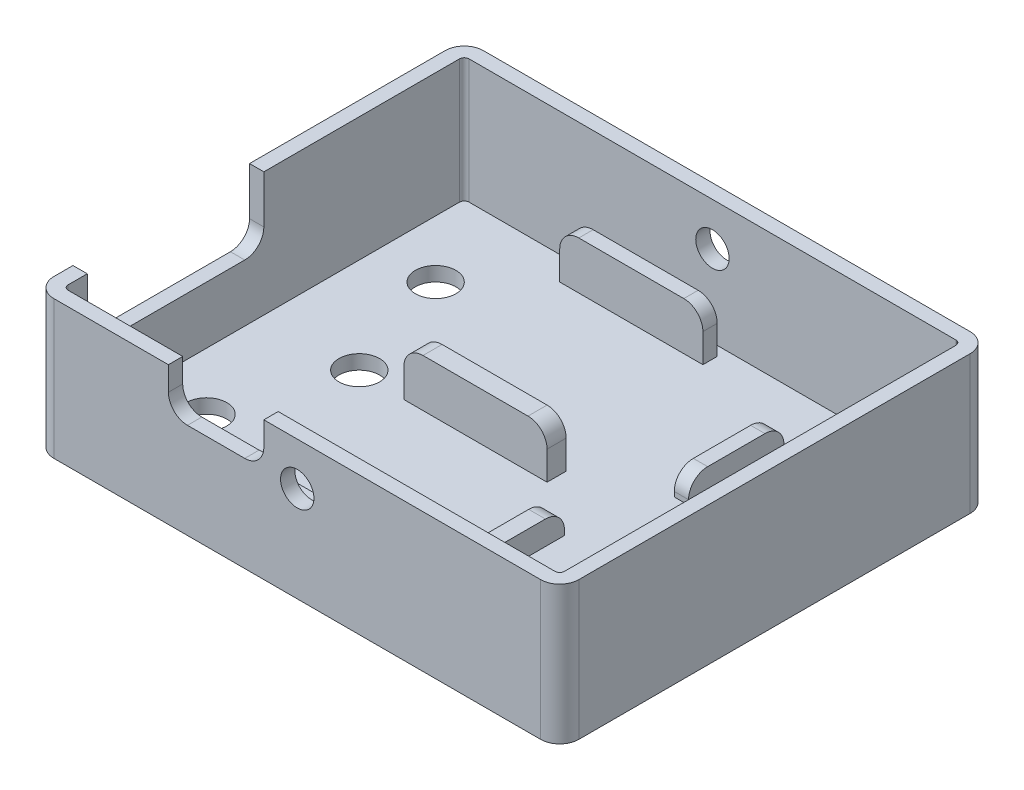
from build123d import *

# Parameters (mm, degrees)
SALIENTE_EXTRUIR1_DEPTH = 1.5
SALIENTE_EXTRUIR3_DEPTH = 13
CROQUIS4_W              = 15
CROQUIS4_H              = 1.5
CROQUIS4_H_2            = 2
SALIENTE_EXTRUIR4_DEPTH = 5
CROQUIS5_W              = 1.5
CROQUIS5_H              = 10
CROQUIS5_W_2            = 1.75
SALIENTE_EXTRUIR5_DEPTH = 2.5
CROQUIS6_W              = 18.5
CROQUIS6_H              = 7
CORTAR_EXTRUIR1_DEPTH   = 1.5
CROQUIS7_W              = 10
CROQUIS7_H              = 4.5
CORTAR_EXTRUIR2_DEPTH   = 1.5
CROQUIS8_R              = 2.25
CROQUIS8_R_2            = 1.5
SALIENTE_EXTRUIR6_DEPTH = 2.25
CORTAR_EXTRUIR3_REACH   = 56.695
CROQUIS9_R              = 1.75
CROQUIS10_R             = 2.125
CORTAR_EXTRUIR4_DEPTH   = 1.5
CROQUIS11_R             = 2.125
CORTAR_EXTRUIR5_DEPTH   = 1.5
SALIENTE_EXTRUIR8_DEPTH = 1.5
SALIENTE_EXTRUIR9_DEPTH = 1.5
REDONDEO2_R             = 2


with BuildPart() as part:
    # Croquis1 → Saliente-Extruir1 (new body)
    with BuildSketch(Plane(origin=(0, 0, 0), x_dir=(1, 0, 0), z_dir=(0, 1, 0))):
        with BuildLine():
            Line((-25.5, -22.5), (25.5, -22.5))
            ThreePointArc((25.5, -22.5), (26.914213562, -21.914213562), (27.5, -20.5))
            Line((27.5, -20.5), (27.5, 20.5))
            ThreePointArc((27.5, 20.5), (26.914213562, 21.914213562), (25.5, 22.5))
            Line((25.5, 22.5), (-25.5, 22.5))
            ThreePointArc((-25.5, 22.5), (-26.914213562, 21.914213562), (-27.5, 20.5))
            Line((-27.5, 20.5), (-27.5, -20.5))
            ThreePointArc((-27.5, -20.5), (-26.914213562, -21.914213562), (-25.5, -22.5))
        make_face()
    extrude(amount=SALIENTE_EXTRUIR1_DEPTH)

    # Croquis3 → Saliente-Extruir3 (add)
    with BuildSketch(Plane(origin=(0, 1.5, 0), x_dir=(1, 0, 0), z_dir=(0, 1, 0))):
        with BuildLine():
            Line((-25.5, 22.5), (25.5, 22.5))
            ThreePointArc((25.5, 22.5), (26.914213562, 21.914213562), (27.5, 20.5))
            Line((27.5, 20.5), (27.5, -20.5))
            ThreePointArc((27.5, -20.5), (26.914213562, -21.914213562), (25.5, -22.5))
            Line((25.5, -22.5), (-25.5, -22.5))
            ThreePointArc((-25.5, -22.5), (-26.914213562, -21.914213562), (-27.5, -20.5))
            Line((-27.5, -20.5), (-27.5, 20.5))
            ThreePointArc((-27.5, 20.5), (-26.914213562, 21.914213562), (-25.5, 22.5))
        make_face()
        with BuildLine():
            Line((-25.5, 21), (25.5, 21))
            ThreePointArc((25.5, 21), (25.853553391, 20.853553391), (26, 20.5))
            Line((26, 20.5), (26, -20.5))
            ThreePointArc((26, -20.5), (25.853553391, -20.853553391), (25.5, -21))
            Line((25.5, -21), (-25.5, -21))
            ThreePointArc((-25.5, -21), (-25.853553391, -20.853553391), (-26, -20.5))
            Line((-26, -20.5), (-26, 20.5))
            ThreePointArc((-26, 20.5), (-25.853553391, 20.853553391), (-25.5, 21))
        make_face(mode=Mode.SUBTRACT)
    extrude(amount=SALIENTE_EXTRUIR3_DEPTH)

    # Croquis4 → Saliente-Extruir4 (add)
    with BuildSketch(Plane(origin=(0, 1.5, 0), x_dir=(1, 0, 0), z_dir=(0, 1, 0))):
        with Locations((-6, 19.25)):
            Rectangle(CROQUIS4_W, CROQUIS4_H)
        with Locations((-6, -19.25)):
            Rectangle(CROQUIS4_W, CROQUIS4_H)
        with Locations((-3.5, 0.675)):
            Rectangle(CROQUIS4_W, CROQUIS4_H_2)
    extrude(amount=SALIENTE_EXTRUIR4_DEPTH)

    # Croquis5 → Saliente-Extruir5 (add)
    with BuildSketch(Plane(origin=(0, 1.5, 0), x_dir=(1, 0, 0), z_dir=(0, 1, 0))):
        with Locations((12.75, 10)):
            Rectangle(CROQUIS5_W, CROQUIS5_H)
        with Locations((8.875, -9.25)):
            Rectangle(CROQUIS5_W_2, CROQUIS5_H)
    extrude(amount=SALIENTE_EXTRUIR5_DEPTH)

    # Croquis6 → Cortar-Extruir1 (cut)
    with BuildSketch(Plane.ZY.offset(27.5)):
        with Locations((9.25, 11)):
            Rectangle(CROQUIS6_W, CROQUIS6_H)
    extrude(amount=-CORTAR_EXTRUIR1_DEPTH, mode=Mode.SUBTRACT)

    # Croquis7 → Cortar-Extruir2 (cut)
    with BuildSketch(Plane.XY.offset(22.5)):
        with Locations((-8.5, 12.25)):
            Rectangle(CROQUIS7_W, CROQUIS7_H)
    extrude(amount=-CORTAR_EXTRUIR2_DEPTH, mode=Mode.SUBTRACT)

    # Croquis8 → Saliente-Extruir6 (add)
    # profile 1 of 2: a face of its own
    with BuildSketch(Plane(origin=(0, 1.5, 0), x_dir=(1, 0, 0), z_dir=(0, 1, 0))):
        with Locations(Location((23, -18, 0), (0, 0, 270))):
            Circle(CROQUIS8_R)
        with Locations(Location((23, -18, 0), (0, 0, 270))):
            Circle(CROQUIS8_R_2, mode=Mode.SUBTRACT)
    # profile 2 of 2: a face of its own
    with BuildSketch(Plane(origin=(0, 1.5, 0), x_dir=(1, 0, 0), z_dir=(0, 1, 0))):
        with Locations(Location((23, -0.5, 0), (0, 0, 270))):
            Circle(CROQUIS8_R)
        with Locations(Location((23, -0.5, 0), (0, 0, 270))):
            Circle(CROQUIS8_R_2, mode=Mode.SUBTRACT)
    extrude(amount=SALIENTE_EXTRUIR6_DEPTH)

    # Cortar-Extruir3: up to this face of the body (flat: up to its plane)
    cortar_extruir3_end = Plane(part.part.faces().sort_by_distance((0.55075594, 6.926025918, 22.5))[0])
    # Croquis9 → Cortar-Extruir3 (cut, up to the picked face)
    with BuildSketch(Plane(origin=(0, 0, -22.5), x_dir=(-1, 0, 0), z_dir=(0, 0, -1)), mode=Mode.PRIVATE) as cortar_extruir3_sk1:
        with Locations((0, 10)):
            Circle(CROQUIS9_R)
    cortar_extruir3_tool1 = split(extrude(cortar_extruir3_sk1.sketch, amount=-CORTAR_EXTRUIR3_REACH, mode=Mode.PRIVATE), bisect_by=cortar_extruir3_end, keep=Keep.BOTH, mode=Mode.PRIVATE)
    add(cortar_extruir3_tool1.solids().sort_by(Axis((0, 10, -22.5), (0, 0, 1)))[0], mode=Mode.SUBTRACT)

    # Croquis10 → Cortar-Extruir4 (cut)
    with BuildSketch(Plane(origin=(0, 1.5, 0), x_dir=(1, 0, 0), z_dir=(0, 1, 0))):
        with Locations(Location((-16, 0, 0), (0, 0, 270))):
            Circle(CROQUIS10_R)
        with Locations(Location((16, 0, 0), (0, 0, 270))):
            Circle(CROQUIS10_R)
    extrude(amount=-CORTAR_EXTRUIR4_DEPTH, mode=Mode.SUBTRACT)

    # Croquis11 → Cortar-Extruir5 (cut)
    with BuildSketch(Plane(origin=(0, 1.5, 0), x_dir=(1, 0, 0), z_dir=(0, 1, 0))):
        with Locations(Location((-20, 12, 0), (0, 0, 270))):
            Circle(CROQUIS11_R)
        with Locations(Location((20, 12, 0), (0, 0, 270))):
            Circle(CROQUIS11_R)
        with Locations(Location((20, -12, 0), (0, 0, 270))):
            Circle(CROQUIS11_R)
        with Locations(Location((-20, -12, 0), (0, 0, 270))):
            Circle(CROQUIS11_R)
    extrude(amount=-CORTAR_EXTRUIR5_DEPTH, mode=Mode.SUBTRACT)

    # Croquis12 → Saliente-Extruir8 (add)
    with BuildSketch(Plane.ZY.offset(27.5)):
        with BuildLine():
            Line((0, 7.5), (2, 7.5))
            ThreePointArc((2, 7.5), (0.585786438, 8.085786438), (0, 9.5))
            Line((0, 9.5), (0, 7.5))
        make_face()
        with BuildLine():
            Line((18.5, 9.5), (18.5, 7.5))
            Line((18.5, 7.5), (16.5, 7.5))
            ThreePointArc((16.5, 7.5), (17.914213562, 8.085786438), (18.5, 9.5))
        make_face()
    extrude(amount=-SALIENTE_EXTRUIR8_DEPTH)

    # Croquis13 → Saliente-Extruir9 (add)
    with BuildSketch(Plane.XY.offset(22.5)):
        with BuildLine():
            Line((-13.5, 12), (-13.5, 10))
            Line((-13.5, 10), (-11.5, 10))
            ThreePointArc((-11.5, 10), (-12.914213562, 10.585786438), (-13.5, 12))
        make_face()
        with BuildLine():
            Line((-3.5, 12), (-3.5, 10))
            Line((-3.5, 10), (-5.5, 10))
            ThreePointArc((-5.5, 10), (-4.085786438, 10.585786438), (-3.5, 12))
        make_face()
    extrude(amount=-SALIENTE_EXTRUIR9_DEPTH)

    # Redondeo2
    redondeo2_edges = [part.edges().sort_by_distance(p)[0] for p in [
        (12.75, 4, -15),
        (12.75, 4, -5),
        (8.875, 4, 4.25),
        (8.875, 4, 14.25),
        (-13.5, 6.5, -19.25),
        (1.5, 6.5, -19.25),
        (1.5, 6.5, 19.25),
        (-13.5, 6.5, 19.25),
        (-11, 6.5, -0.675),
        (4, 6.5, -0.675),
    ]]
    fillet(redondeo2_edges, radius=REDONDEO2_R)


solid = part.part
